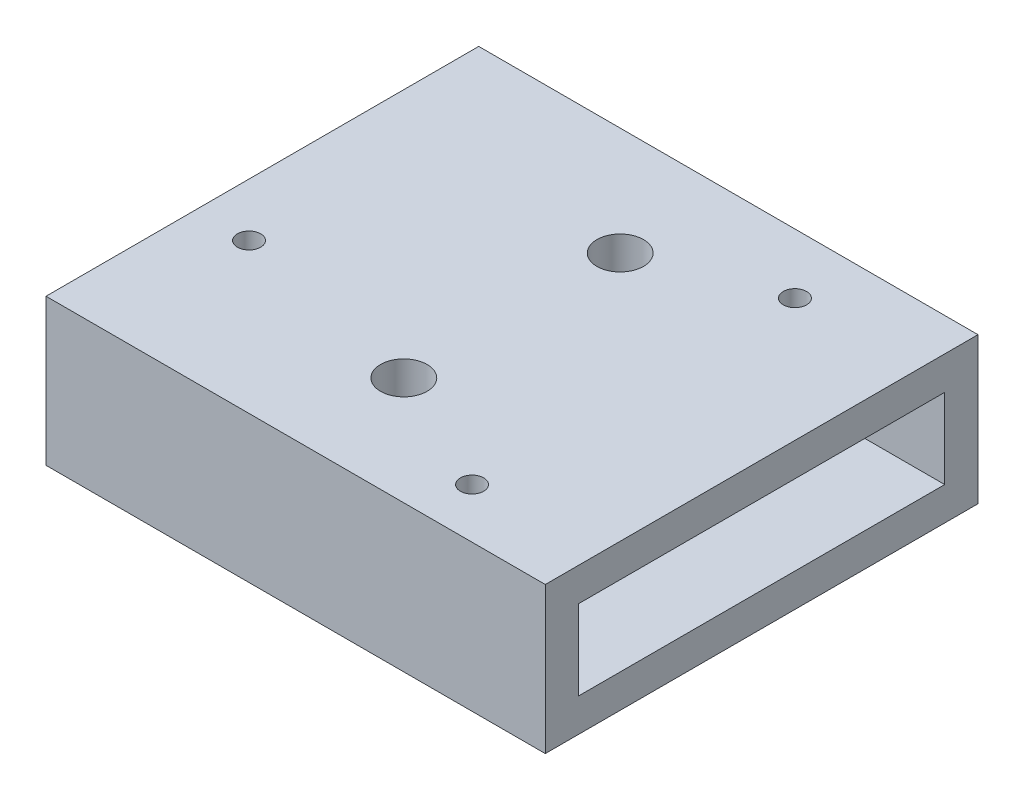
from build123d import *

# Parameters (mm, degrees)
SKETCH1_W           = 75
SKETCH1_H           = 65
BOSS_EXTRUDE1_DEPTH = 22
SKETCH2_W           = 55
SKETCH2_H           = 12
CUT_EXTRUDE1_DEPTH  = 70
SKETCH3_W           = 15
SKETCH3_H           = 12
CUT_EXTRUDE2_DEPTH  = 85.647799735
SKETCH4_R           = 1.75
CUT_EXTRUDE3_DEPTH  = 55.281672782
SKETCH7_R           = 1.75
CUT_EXTRUDE5_DEPTH  = 55.281672782
SKETCH8_R           = 1.75
CUT_EXTRUDE6_DEPTH  = 55.281672782
SKETCH9_R           = 3.5
CUT_EXTRUDE7_DEPTH  = 6
SKETCH10_R          = 3.5
CUT_EXTRUDE8_DEPTH  = 6


with BuildPart() as part:
    # Sketch1 → Boss-Extrude1 (new body)
    with BuildSketch(Plane(origin=(0, 0, 0), x_dir=(1, 0, 0), z_dir=(0, 1, 0))):
        Rectangle(SKETCH1_W, SKETCH1_H)
    extrude(amount=BOSS_EXTRUDE1_DEPTH)

    # Sketch2 → Cut-Extrude1 (cut)
    with BuildSketch(Plane(origin=(37.5, 0, 0), x_dir=(0, 0, -1), z_dir=(1, 0, 0))):
        with Locations((0, 11)):
            Rectangle(SKETCH2_W, SKETCH2_H)
    extrude(amount=-CUT_EXTRUDE1_DEPTH, mode=Mode.SUBTRACT)

    # Sketch3 → Cut-Extrude2 (cut, through all)
    with BuildSketch(Plane.ZY.offset(37.5)):
        with Locations((-17, 11)):
            Rectangle(SKETCH3_W, SKETCH3_H)
    extrude(amount=-CUT_EXTRUDE2_DEPTH, mode=Mode.SUBTRACT)

    # Sketch4 → Cut-Extrude3 (cut, through all)
    with BuildSketch(Plane(origin=(0, 22, 0), x_dir=(1, 0, 0), z_dir=(0, 1, 0))):
        with Locations(Location((19, -25, 0), (0, 0, 270))):
            Circle(SKETCH4_R)
    extrude(amount=-CUT_EXTRUDE3_DEPTH, mode=Mode.SUBTRACT)

    # Sketch7 → Cut-Extrude5 (cut, through all)
    with BuildSketch(Plane(origin=(0, 22, 0), x_dir=(1, 0, 0), z_dir=(0, 1, 0))):
        with Locations(Location((19, 23.5, 0), (0, 0, 270))):
            Circle(SKETCH7_R)
    extrude(amount=-CUT_EXTRUDE5_DEPTH, mode=Mode.SUBTRACT)

    # Sketch8 → Cut-Extrude6 (cut, through all)
    with BuildSketch(Plane(origin=(0, 22, 0), x_dir=(1, 0, 0), z_dir=(0, 1, 0))):
        with Locations(Location((-29.5, -10, 0), (0, 0, 270))):
            Circle(SKETCH8_R)
    extrude(amount=-CUT_EXTRUDE6_DEPTH, mode=Mode.SUBTRACT)

    # Sketch9 → Cut-Extrude7 (cut)
    with BuildSketch(Plane(origin=(0, 22, 0), x_dir=(1, 0, 0), z_dir=(0, 1, 0))):
        with Locations(Location((0, -16.25, 0), (0, 0, 270))):
            Circle(SKETCH9_R)
    extrude(amount=-CUT_EXTRUDE7_DEPTH, mode=Mode.SUBTRACT)

    # Sketch10 → Cut-Extrude8 (cut)
    with BuildSketch(Plane(origin=(0, 22, 0), x_dir=(1, 0, 0), z_dir=(0, 1, 0))):
        with Locations(Location((0, 16.25, 0), (0, 0, 270))):
            Circle(SKETCH10_R)
    extrude(amount=-CUT_EXTRUDE8_DEPTH, mode=Mode.SUBTRACT)


solid = part.part
